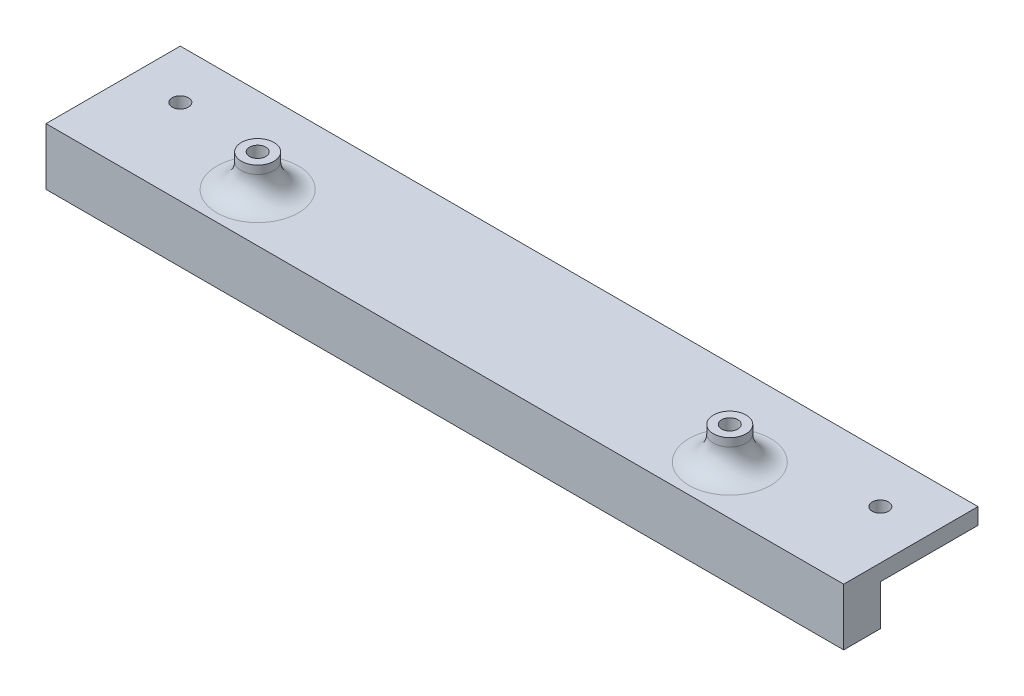
from build123d import *

# Parameters (mm, degrees)
SKETCH_10_R     = 1
EXTRUDE_5_DEPTH = 5
EXTRUDE_START   = 2
SKETCH_10_4_W   = 97.99999928
SKETCH_10_4_H   = 16.500549096
SKETCH_10_4_R   = 1
EXTRUDE_6_DEPTH = 2
EXTRUDE_START_2 = 4
SKETCH_11_R     = 2
SKETCH_11_R_2   = 1
EXTRUDE_8_DEPTH = 4
FILLET_30_R     = 3


with BuildPart() as part:
    # 草图10 → 凸台-拉伸5 (new body)
    with BuildSketch(Plane(origin=(0, 10, 0), x_dir=(1, 0, 0), z_dir=(0, 1, 0))):
        Polygon((8.00000036, 17.5), (-3.99999964, 17.5), (-3.99999964, 12.999450904), (93.99999964, 12.999450904), (93.99999964, 17.5), (81.99999964, 17.5), (81.99999964, 29.5), (8.00000036, 29.5), align=None)
        with Locations((16.003399367, 18.999450904)):
            Circle(SKETCH_10_R, mode=Mode.SUBTRACT)
        with Locations((74.003399367, 18.999450904)):
            Circle(SKETCH_10_R, mode=Mode.SUBTRACT)
    extrude(amount=-EXTRUDE_5_DEPTH)

    # 草图10<4> → 凸台-拉伸6 (add)
    with BuildSketch(Plane(origin=(0, 10, 0), x_dir=(1, 0, 0), z_dir=(0, 1, 0)).offset(EXTRUDE_START)):
        with Locations((45, 21.249725452)):
            Rectangle(SKETCH_10_4_W, SKETCH_10_4_H)
        with Locations((2.00000036, 23.5)):
            Circle(SKETCH_10_4_R, mode=Mode.SUBTRACT)
        with Locations((88.00000036, 23.5)):
            Circle(SKETCH_10_4_R, mode=Mode.SUBTRACT)
        with Locations((16.003399367, 18.999450904)):
            Circle(SKETCH_10_4_R, mode=Mode.SUBTRACT)
        with Locations((74.003399367, 18.999450904)):
            Circle(SKETCH_10_4_R, mode=Mode.SUBTRACT)
    extrude(amount=-EXTRUDE_6_DEPTH)

    # 草图11 → 凸台-拉伸8 (add)
    # profile 1 of 2: a face of its own
    with BuildSketch(Plane(origin=(0, 12, 0), x_dir=(1, 0, 0), z_dir=(0, 1, 0)).offset(EXTRUDE_START_2)):
        with Locations((16.003399367, 18.999450904)):
            Circle(SKETCH_11_R)
        with Locations((16.003399367, 18.999450904)):
            Circle(SKETCH_11_R_2, mode=Mode.SUBTRACT)
    # profile 2 of 2: a face of its own
    with BuildSketch(Plane(origin=(0, 12, 0), x_dir=(1, 0, 0), z_dir=(0, 1, 0)).offset(EXTRUDE_START_2)):
        with Locations((74.003399367, 18.999450904)):
            Circle(SKETCH_11_R)
        with Locations((74.003399367, 18.999450904)):
            Circle(SKETCH_11_R_2, mode=Mode.SUBTRACT)
    extrude(amount=-EXTRUDE_8_DEPTH)

    # 圆角30
    fillet_30_edges = [part.edges().sort_by_distance(p)[0] for p in [
        (14.003399367, 12, -18.999450904),
        (72.003399367, 12, -18.999450904),
    ]]
    fillet(fillet_30_edges, radius=FILLET_30_R)


solid = part.part
